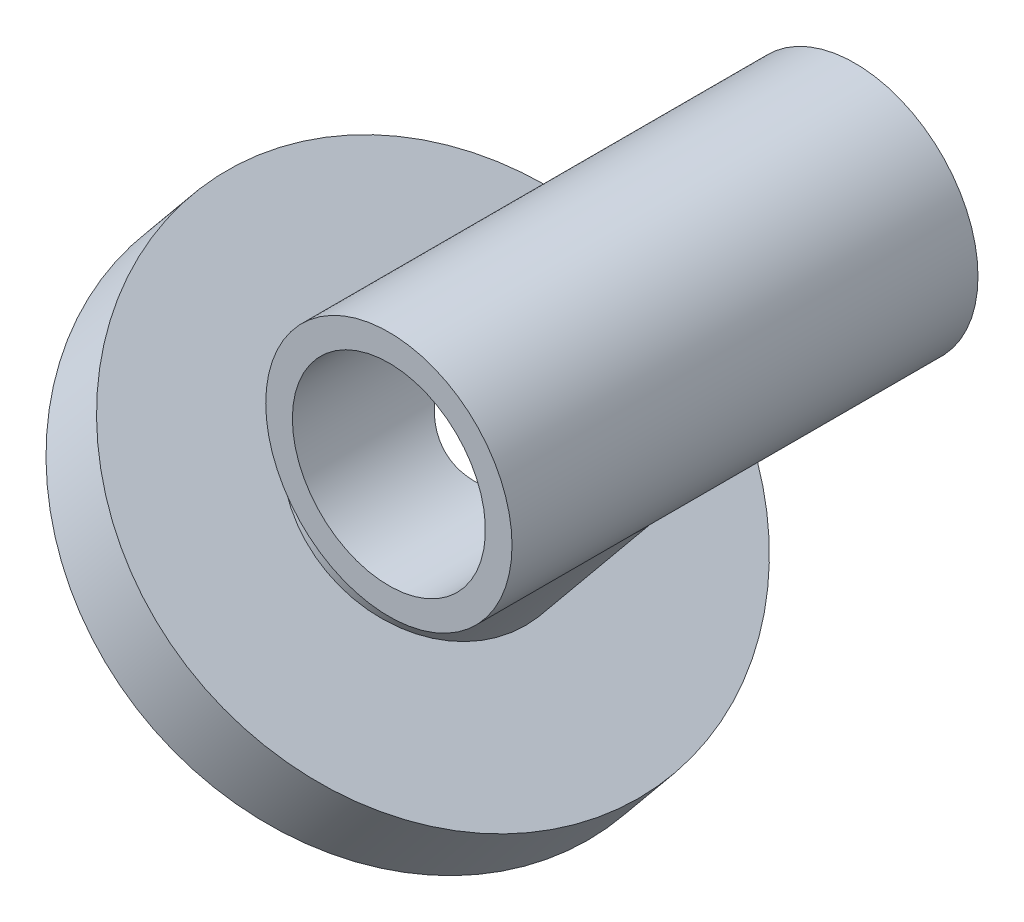
from build123d import *

# Parameters (mm, degrees)
TROU_DE_PASSAGE_D_AXE_3_321_REACH  = 32.636
TROU_DE_PASSAGE_D_AXE_3_321_BORE_R = 5
TROU_DE_PASSAGE_D_AXE_3_322_D      = 14.5


with BuildPart() as part:
    # Esquisse1 → Révolution1 (revolve)
    with BuildSketch(Plane(origin=(0, 0, 0), x_dir=(1, 0, 0), z_dir=(0, 1, 0)), mode=Mode.PRIVATE) as r_volution1_sk:
        Polygon((7.250000000000006, 51.46955999467971), (7.2500000000000115, 16.46955999467971), (9.250000000000007, 16.46955999467971), (9.250000000000007, 51.46955999467971), align=None)
    revolve(r_volution1_sk.sketch.rotate(Axis((0, 0, -65.50671272050145), (0, 0, 1)), 180), axis=Axis((0, 0, -65.50671272050145), (0, 0, 1)))

    # Trou de passage d'axe 3/321 bore (on position points) → Trou de passage d'axe 3/321 (cut, up to next)
    with BuildSketch(Plane(origin=(-5.876504309, -7.143472342, -30.469559995), x_dir=(-0.772267280236, 0.635297763161, 0), z_dir=(-0.635297763161, -0.772267280236, 0)), mode=Mode.PRIVATE) as trou_de_passage_d_axe_3_321_sk1:
        Circle(TROU_DE_PASSAGE_D_AXE_3_321_BORE_R)
    trou_de_passage_d_axe_3_321_tool1 = extrude(trou_de_passage_d_axe_3_321_sk1.sketch, amount=-TROU_DE_PASSAGE_D_AXE_3_321_REACH, mode=Mode.PRIVATE) & part.part
    add(trou_de_passage_d_axe_3_321_tool1.solids().sort_by_distance((-5.876504, -7.143472, -30.46956))[0], mode=Mode.SUBTRACT)

    # Esquisse6 → Révolution2 (revolve)
    with BuildSketch(Plane(origin=(0, 0, 0), x_dir=(0, 0, -1), z_dir=(0.7722672802355546, -0.6352977631611647, 0)), mode=Mode.PRIVATE) as r_volution2_sk:
        Polygon((22.469559994679706, -16.22010142633931), (22.469559994679706, -17.826400392261572), (11.469559994679708, -17.826400392261572), (11.469559994679708, -22.802862204144958), (10.469559994679706, -22.802862204144958), (10.469559994679706, -16.826400392261576), (21.469559994679706, -16.826400392261572), (21.469559994679706, -16.22010142633931), (21.469559994679706, -3.2201014263393115), (22.469559994679706, -3.2201014263393115), align=None)
    revolve(r_volution2_sk.sketch.rotate(Axis((-13.132857470311126, -15.964287470260585, -30.469559994679706), (0.6352977631611647, 0.7722672802355546, 0)), 90), axis=Axis((-13.132857470311126, -15.964287470260585, -30.469559994679706), (0.6352977631611647, 0.7722672802355546, 0)))

    # Trou de passage d'axe 3/322 (through all)
    with Locations(Plane(origin=(0, 0, -39.469559995), x_dir=(0, -1, 0), z_dir=(0, 0, -1))):
        with Locations((0, 0)):
            Hole(TROU_DE_PASSAGE_D_AXE_3_322_D / 2)


solid = part.part
